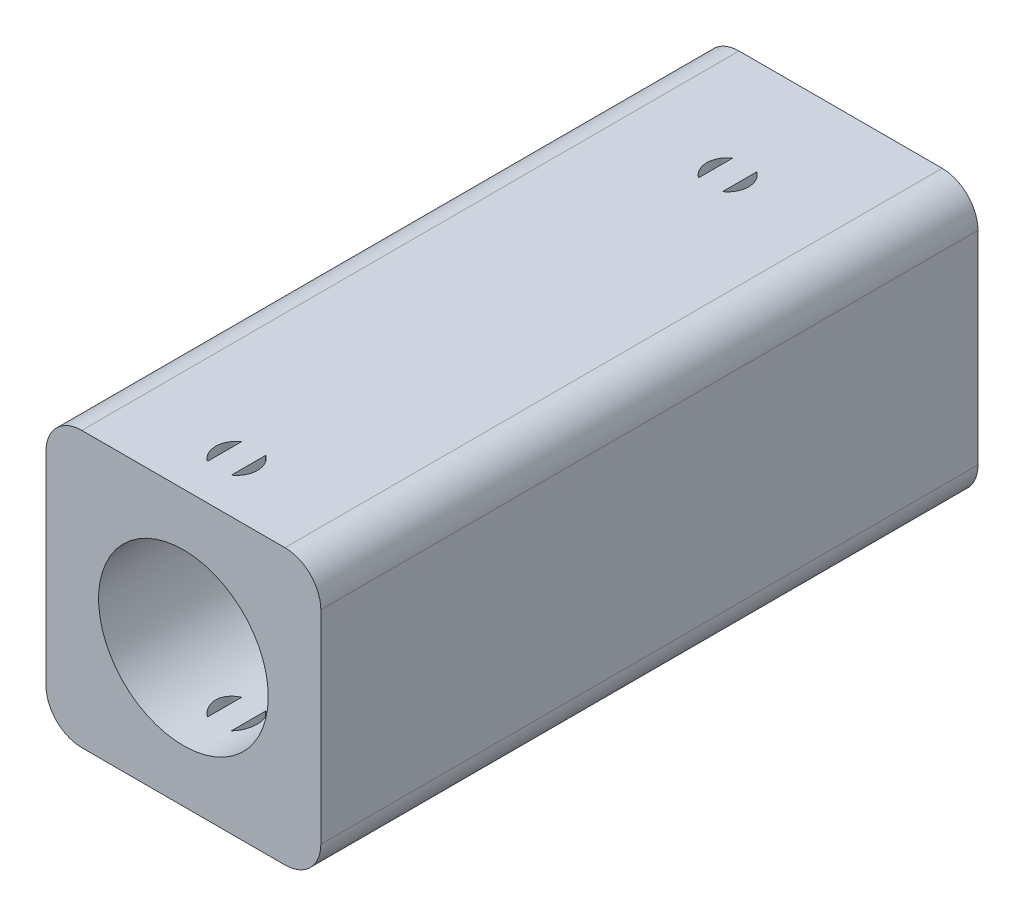
from build123d import *

# Parameters (mm, degrees)
SCHIZZO1_W                        = 23
SCHIZZO1_H                        = 23
ESTRUSIONE_ESTRUSIONE1_DEPTH      = 55
TAGLIO_ESTRUSIONE12_REACH         = 60.671
SCHIZZO18_R                       = 7.1
SMUSSO4_SIZE                      = 1
SMUSSO4_SIZE2                     = 3
SCHIZZO19_R                       = 1.75
TAGLIO_ESTRUSIONE13_DEPTH         = 62.486055435
ESTRUSIONE_ESTRUSIONE2_REACH      = 63.486
ESTRUSIONE_ESTRUSIONE2_END_RADIUS = 7.1
SCHIZZO20_W                       = 2
SCHIZZO20_H                       = 3.5
ESTRUSIONE_ESTRUSIONE3_REACH      = 63.486
ESTRUSIONE_ESTRUSIONE3_END_RADIUS = 7.1
SCHIZZO21_W                       = 2
SCHIZZO21_H                       = 3.5
RACCORDO1_R                       = 3


with BuildPart() as part:
    # Schizzo1 → Estrusione-Estrusione1 (new body)
    with BuildSketch(Plane.XY):
        with Locations((-3.551080126, 2.313028552)):
            Rectangle(SCHIZZO1_W, SCHIZZO1_H)
    extrude(amount=ESTRUSIONE_ESTRUSIONE1_DEPTH)

    # Schizzo18 → Taglio-Estrusione12 (cut, up to next)
    with BuildSketch(Plane(origin=(0, 0, 0), x_dir=(-1, 0, 0), z_dir=(0, 0, -1)), mode=Mode.PRIVATE) as taglio_estrusione12_sk1:
        with Locations((3.551080126, 2.313028552)):
            Circle(SCHIZZO18_R)
    taglio_estrusione12_tool1 = extrude(taglio_estrusione12_sk1.sketch, amount=-TAGLIO_ESTRUSIONE12_REACH, mode=Mode.PRIVATE) & part.part
    add(taglio_estrusione12_tool1.solids().sort_by_distance((-3.55108, 2.313029, 0))[0], mode=Mode.SUBTRACT)

    # Smusso4
    smusso4_edges = [part.edges().sort_by_distance(p)[0] for p in [
        (3.548919874, 2.313028552, 0),
    ]]
    smusso4_side = [part.faces().sort_by_distance(p)[0] for p in [
        (-3.551080126, 13.487759433, 0),
    ]]
    chamfer(smusso4_edges, length=SMUSSO4_SIZE, length2=SMUSSO4_SIZE2, reference=smusso4_side[0])

    # Schizzo19 → Taglio-Estrusione13 (cut, through all)
    with BuildSketch(Plane(origin=(0, 13.813028552, 0), x_dir=(1, 0, 0), z_dir=(0, 1, 0))):
        with Locations(Location((-3.551080126, -50.55, 0), (0, 0, 180))):
            Circle(SCHIZZO19_R)
        with Locations(Location((-3.551080126, -9.45, 0), (0, 0, 180))):
            Circle(SCHIZZO19_R)
    extrude(amount=-TAGLIO_ESTRUSIONE13_DEPTH, mode=Mode.SUBTRACT)

    # Estrusione-Estrusione2: up to this cylinder (the profile starts outside it)
    estrusione_estrusione2_end = Plane(origin=(-3.551080126, 2.313028552, 30), z_dir=(0, 0, -1)) * Cylinder(ESTRUSIONE_ESTRUSIONE2_END_RADIUS, 183.272, mode=Mode.PRIVATE)
    # Schizzo20 → Estrusione-Estrusione2 (add, up to the surface)
    with BuildSketch(Plane(origin=(0, 13.813028552, 0), x_dir=(1, 0, 0), z_dir=(0, 1, 0)), mode=Mode.PRIVATE) as estrusione_estrusione2_sk1:
        with Locations((-3.551080126, -50.55)):
            Rectangle(SCHIZZO20_W, SCHIZZO20_H)
    estrusione_estrusione2_tool1 = extrude(estrusione_estrusione2_sk1.sketch, amount=-ESTRUSIONE_ESTRUSIONE2_REACH, mode=Mode.PRIVATE) - estrusione_estrusione2_end
    add(estrusione_estrusione2_tool1.solids().sort_by_distance((-3.55108, 13.813029, 50.55))[0])
    # Schizzo20 → Estrusione-Estrusione2 (add, up to the surface)
    with BuildSketch(Plane(origin=(0, 13.813028552, 0), x_dir=(1, 0, 0), z_dir=(0, 1, 0)), mode=Mode.PRIVATE) as estrusione_estrusione2_sk2:
        with Locations((-3.551080126, -9.45)):
            Rectangle(SCHIZZO20_W, SCHIZZO20_H)
    estrusione_estrusione2_tool2 = extrude(estrusione_estrusione2_sk2.sketch, amount=-ESTRUSIONE_ESTRUSIONE2_REACH, mode=Mode.PRIVATE) - estrusione_estrusione2_end
    add(estrusione_estrusione2_tool2.solids().sort_by_distance((-3.55108, 13.813029, 9.45))[0])

    # Estrusione-Estrusione3: up to this cylinder (the profile starts outside it)
    estrusione_estrusione3_end = Plane(origin=(-3.551080126, 2.313028552, 30), z_dir=(0, 0, -1)) * Cylinder(ESTRUSIONE_ESTRUSIONE3_END_RADIUS, 183.272, mode=Mode.PRIVATE)
    # Schizzo21 → Estrusione-Estrusione3 (add, up to the surface)
    with BuildSketch(Plane.XZ.offset(9.186971448), mode=Mode.PRIVATE) as estrusione_estrusione3_sk1:
        with Locations((-3.551080126, 9.45)):
            Rectangle(SCHIZZO21_W, SCHIZZO21_H)
    estrusione_estrusione3_tool1 = extrude(estrusione_estrusione3_sk1.sketch, amount=-ESTRUSIONE_ESTRUSIONE3_REACH, mode=Mode.PRIVATE) - estrusione_estrusione3_end
    add(estrusione_estrusione3_tool1.solids().sort_by_distance((-3.55108, -9.186971, 9.45))[0])
    # Schizzo21 → Estrusione-Estrusione3 (add, up to the surface)
    with BuildSketch(Plane.XZ.offset(9.186971448), mode=Mode.PRIVATE) as estrusione_estrusione3_sk2:
        with Locations((-3.551080126, 50.55)):
            Rectangle(SCHIZZO21_W, SCHIZZO21_H)
    estrusione_estrusione3_tool2 = extrude(estrusione_estrusione3_sk2.sketch, amount=-ESTRUSIONE_ESTRUSIONE3_REACH, mode=Mode.PRIVATE) - estrusione_estrusione3_end
    add(estrusione_estrusione3_tool2.solids().sort_by_distance((-3.55108, -9.186971, 50.55))[0])

    # Raccordo1
    raccordo1_edges = [part.edges().sort_by_distance(p)[0] for p in [
        (7.948919874, 13.813028552, 27.5),
        (7.948919874, -9.186971448, 27.5),
        (-15.051080126, -9.186971448, 27.5),
        (-15.051080126, 13.813028552, 27.5),
    ]]
    fillet(raccordo1_edges, radius=RACCORDO1_R)


solid = part.part
